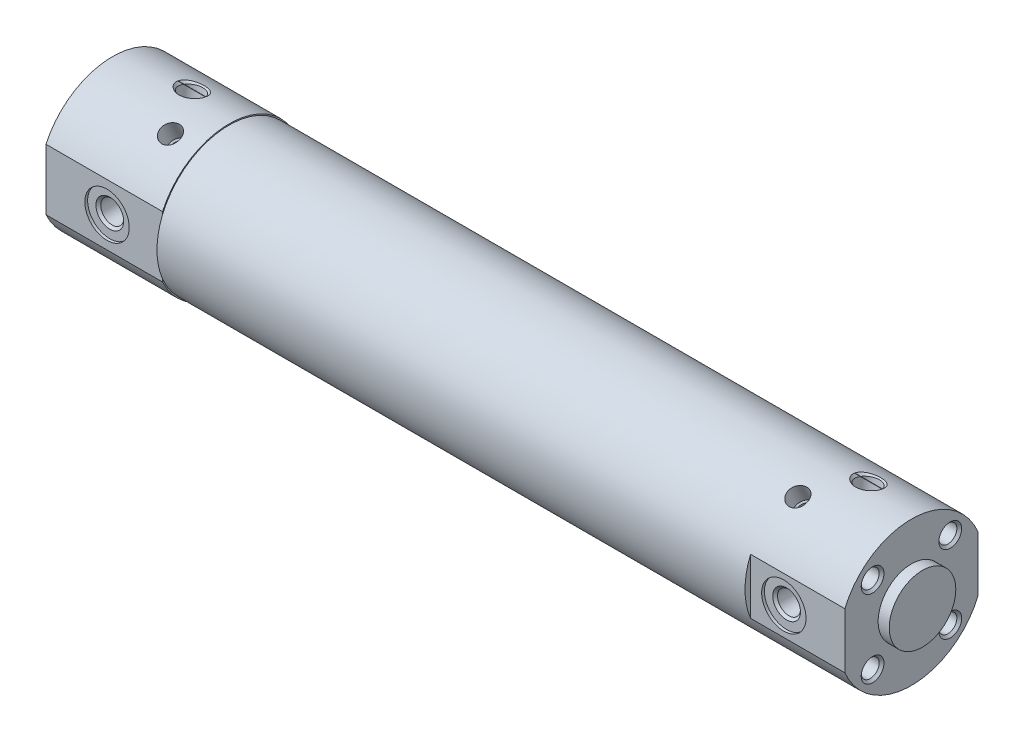
from build123d import *

# Parameters (mm, degrees)
EXTRUDE_1_DEPTH                = 21
SKETCH_2_R                     = 13
EXTRUDE_2_DEPTH                = 123
CUT_EXTRUDE_START              = -17
CUT_EXTRUDE_1_DEPTH            = 17
CUT_EXTRUDE_2_DEPTH            = 17
SKETCH_5_R                     = 6
EXTRUDE_3_DEPTH                = 2
SKETCH_6_W                     = 2
SKETCH_6_H                     = 6
HOLE_WIZARD_M3_1_D             = 3.242
HOLE_WIZARD_M3_1_DEPTH         = 7
HOLE_WIZARD_M3_1_TIP           = 0.935884786
HOLE_WIZARD_M3_5_1_D           = 4.134
HOLE_WIZARD_M3_5_1_DEPTH       = 6
HOLE_WIZARD_M3_5_1_CBORE_D     = 8
HOLE_WIZARD_M3_5_1_CBORE_DEPTH = 0.5
HOLE_WIZARD_M3_5_2_D           = 4.134
HOLE_WIZARD_M3_5_2_DEPTH       = 6
HOLE_WIZARD_M3_5_2_CBORE_D     = 8
HOLE_WIZARD_M3_5_2_CBORE_DEPTH = 0.5
HOLE_WIZARD_M3_2_D             = 3.242
HOLE_WIZARD_M3_2_DEPTH         = 7
HOLE_WIZARD_M3_2_TIP           = 0.935884786
CHAMFER_1_SIZE                 = 0.433


with BuildPart() as part:
    # ｽｹｯﾁ1 → ﾎﾞｽ - 押し出し1 (new body)
    with BuildSketch(Plane(origin=(0, 0, 0), x_dir=(0, -1, 0), z_dir=(-1, 0, 0))):
        with BuildLine():
            Line((-5.499090807, -12.000000012), (5.499090807, -12.000000012))
            ThreePointArc((5.499090807, -12.000000012), (13.2, 0), (5.499090807, 12.000000012))
            Line((5.499090807, 12.000000012), (-5.499090807, 12.000000012))
            ThreePointArc((-5.499090807, 12.000000012), (-13.2, 0), (-5.499090807, -12.000000012))
        make_face()
    extrude(amount=-EXTRUDE_1_DEPTH)

    # ｽｹｯﾁ2 → ﾎﾞｽ - 押し出し2 (add)
    with BuildSketch(Plane(origin=(21, 0, 0), x_dir=(0, -1, 0), z_dir=(-1, 0, 0))):
        with Locations(Location((0, 0, 0), (0, 0, 112.619864808))):
            Circle(SKETCH_2_R)
    extrude(amount=-EXTRUDE_2_DEPTH)

    # ｽｹｯﾁ3 → ｶｯﾄ - 押し出し1 (cut)
    with BuildSketch(Plane(origin=(144, 0, 0), x_dir=(0, 0, -1), z_dir=(1, 0, 0)).offset(CUT_EXTRUDE_START)):
        with BuildLine():
            Line((-12, -5), (-12, 5))
            ThreePointArc((-12, 5), (-13, 0), (-12, -5))
        make_face()
    extrude(amount=CUT_EXTRUDE_1_DEPTH, mode=Mode.SUBTRACT)

    # ｽｹｯﾁ4 → ｶｯﾄ - 押し出し2 (cut)
    with BuildSketch(Plane(origin=(144, 0, 0), x_dir=(0, 0, -1), z_dir=(1, 0, 0)).offset(CUT_EXTRUDE_START)):
        with BuildLine():
            Line((12, 5), (12, -5))
            ThreePointArc((12, -5), (13, 0), (12, 5))
        make_face()
    extrude(amount=CUT_EXTRUDE_2_DEPTH, mode=Mode.SUBTRACT)

    # ｽｹｯﾁ5 → ﾎﾞｽ - 押し出し3 (add)
    with BuildSketch(Plane(origin=(144, 0, 0), x_dir=(0, 0, -1), z_dir=(1, 0, 0))):
        Circle(SKETCH_5_R)
    extrude(amount=EXTRUDE_3_DEPTH)

    # ｽｹｯﾁ6 → 回転1 (revolve)
    with BuildSketch(Plane.XY, mode=Mode.PRIVATE) as revolve_1_sk:
        with Locations((-1, 3)):
            Rectangle(SKETCH_6_W, SKETCH_6_H)
    revolve(revolve_1_sk.sketch.rotate(Axis((-2, 0, 0), (1, 0, 0)), 270), axis=Axis((-2, 0, 0), (1, 0, 0)))

    # ｽｹｯﾁ7 → ｶｯﾄ - 回転1 (revolve, cut)
    with BuildSketch(Plane.XY, mode=Mode.PRIVATE) as cut_revolve_1_sk:
        Polygon((-2, 4), (-2, 0), (99, 0), (99, 10), (19, 10), (19, 4), align=None)
    revolve(cut_revolve_1_sk.sketch.rotate(Axis((-2, 0, 0), (1, 0, 0)), 270), axis=Axis((-2, 0, 0), (1, 0, 0)), mode=Mode.SUBTRACT)

    # ｽｹｯﾁ8 → ｶｯﾄ - 回転2 (revolve, cut)
    with BuildSketch(Plane(origin=(16, 0, 0), x_dir=(0, 0, -1), z_dir=(1, 0, 0))):
        Polygon((-3.992522404, 12.702844697), (-5.578561032, 11.963262739), (-1.67721423, 3.596797524), (-1.224060337, 3.808106655), (-2.581245226, 6.718599042), (-1.674937439, 7.141217304), (-2.625828528, 9.180409824), (-2.504906146, 9.512641337), align=None)
    revolve(axis=Axis((16, 11.963262739, 5.578561032), (0, -0.9063077870366498, -0.42261826174069983)), mode=Mode.SUBTRACT)

    # ｽｹｯﾁ9 → ｶｯﾄ - 回転3 (revolve, cut)
    with BuildSketch(Plane(origin=(129, 0, 0), x_dir=(0, 0, -1), z_dir=(1, 0, 0))):
        Polygon((-3.907998745, 12.521583124), (-5.494037372, 11.782001166), (-0.921307811, 1.975750976), (-0.468153917, 2.187060107), (-2.581245226, 6.718599042), (-1.674937439, 7.141217304), (-2.625828528, 9.180409824), (-2.504906146, 9.512641337), align=None)
    revolve(axis=Axis((129, 11.782001166, 5.494037372), (0, -0.9063077870366498, -0.4226182617406999)), mode=Mode.SUBTRACT)

    # M3 すきま穴1
    with Locations(Plane(origin=(144, 0, 0), x_dir=(0, 0, -1), z_dir=(1, 0, 0))):
        with Locations((-7, 7), (-7, -7), (7, -7), (7, 7)):
            Hole(HOLE_WIZARD_M3_1_D / 2, depth=HOLE_WIZARD_M3_1_DEPTH)
            with Locations((0, 0, -(HOLE_WIZARD_M3_1_DEPTH + HOLE_WIZARD_M3_1_TIP / 2))):  # 120° drill point
                Cone(0, HOLE_WIZARD_M3_1_D / 2, HOLE_WIZARD_M3_1_TIP, mode=Mode.SUBTRACT)

    # M3.5 六角小ねじ用座ぐり穴1
    with Locations(Plane.XY.offset(12.000000012)):
        with Locations((11, 0), (133, 0)):
            CounterBoreHole(HOLE_WIZARD_M3_5_1_D / 2, HOLE_WIZARD_M3_5_1_CBORE_D / 2, HOLE_WIZARD_M3_5_1_CBORE_DEPTH, depth=HOLE_WIZARD_M3_5_1_DEPTH)

    # ｽｹｯﾁ14 → M3.5 皿頭小ねじ(100)用皿穴1 (revolve, cut)
    with BuildSketch(Plane(origin=(12, 12.999400949, -2.29214512), x_dir=(0, 0.17364817766692953, 0.9848077530122082), z_dir=(1, 0, 0))):
        Polygon((0, 0), (0, 6.193320669), (2.067, 4.999937663), (2.067, 0.432937663), (2.499937663, 0), align=None)
    revolve(axis=Axis((12, 19.252930181, -3.394811049), (0, -0.9848077530122082, 0.1736481776669295)), mode=Mode.SUBTRACT)

    # M3.5 六角小ねじ用座ぐり穴2
    with Locations(Plane(origin=(0, 0, -12.000000012), x_dir=(-1, 0, 0), z_dir=(0, 0, -1))):
        with Locations((-11, 0), (-133, 0)):
            CounterBoreHole(HOLE_WIZARD_M3_5_2_D / 2, HOLE_WIZARD_M3_5_2_CBORE_D / 2, HOLE_WIZARD_M3_5_2_CBORE_DEPTH, depth=HOLE_WIZARD_M3_5_2_DEPTH)

    # M3 すきま穴2
    with Locations(Plane.ZY):
        with Locations((7, 7), (7, -7), (-7, -7), (-7, 7)):
            Hole(HOLE_WIZARD_M3_2_D / 2, depth=HOLE_WIZARD_M3_2_DEPTH)
            with Locations((0, 0, -(HOLE_WIZARD_M3_2_DEPTH + HOLE_WIZARD_M3_2_TIP / 2))):  # 120° drill point
                Cone(0, HOLE_WIZARD_M3_2_D / 2, HOLE_WIZARD_M3_2_TIP, mode=Mode.SUBTRACT)

    # ｽｹｯﾁ20 → M3.5 皿頭小ねじ(100)用皿穴2 (revolve, cut)
    with BuildSketch(Plane(origin=(134, 12.802438431, -2.257415314), x_dir=(0, 0.1736481776669296, 0.9848077530122082), z_dir=(1, 0, 0))):
        Polygon((0, 0), (0, 6.193319686), (2.067, 4.99993668), (2.067, 0.43293668), (2.49993668, 0), align=None)
    revolve(axis=Axis((134, 19.055967663, -3.360081242), (0, -0.9848077530122082, 0.17364817766692964)), mode=Mode.SUBTRACT)

    # 面取り1
    chamfer_1_edges = [part.edges().sort_by_distance(p)[0] for p in [
        (13.067, 0, 11.500000012),
        (130.933, 0, -11.500000012),
        (8.933, 0, -11.500000012),
        (0, 7, -5.379),
        (0, -7, -5.379),
        (0, -7, 8.621),
        (0, 7, 8.621),
        (144, 7, -8.621),
        (144, -7, -8.621),
        (144, -7, 5.379),
        (144, 7, 5.379),
        (135.067, 0, 11.500000012),
    ]]
    chamfer(chamfer_1_edges, length=CHAMFER_1_SIZE)


solid = part.part
